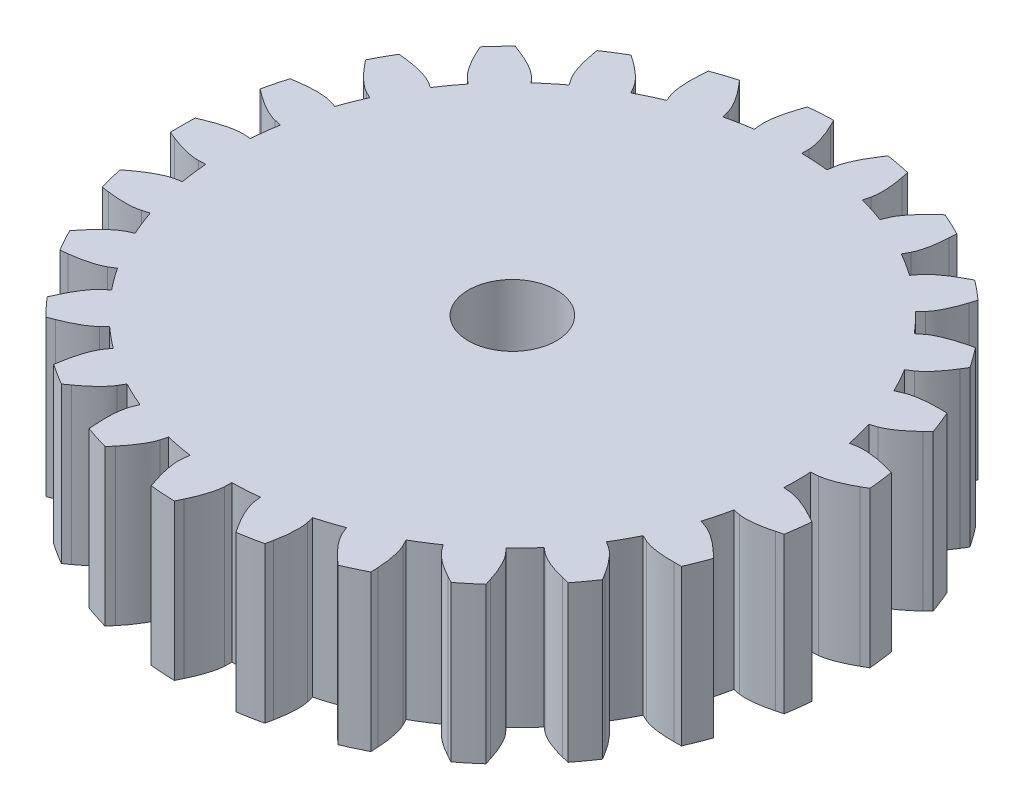
from build123d import *

# Parameters (mm, degrees)
SKETCH5_R           = 27.5
BOSS_EXTRUDE1_DEPTH = 15
BOSS_EXTRUDE2_DEPTH = 15
CIRPATTERN2_COUNT   = 25
SKETCH9_R           = 4.25
CUT_EXTRUDE1_DEPTH  = 48.414177317


with BuildPart() as part:
    # Sketch5 → Boss-Extrude1 (new body)
    with BuildSketch(Plane(origin=(0, 0, 0), x_dir=(1, 0, 0), z_dir=(0, 1, 0))):
        with Locations(Location((0, 0, 0), (0, 0, 270))):
            Circle(SKETCH5_R)
    extrude(amount=BOSS_EXTRUDE1_DEPTH)

    # Sketch7 → Boss-Extrude2 (add)
    with BuildSketch(Plane(origin=(0, 0, 0), x_dir=(1, 0, 0), z_dir=(0, 1, 0))):
        with BuildLine():
            Line((0.419103344, 28.187663113), (0.419103344, 27.496806222))
            ThreePointArc((0.419103344, 27.496806222), (-1.735576403, 27.445177619), (-3.879595269, 27.224965391))
            Line((-3.879595269, 27.224965391), (-3.948649553, 27.912867393))
            add(Edge.make_bspline(
                [(-3.408300207, 30.987456132), (-3.481876172, 30.773678284), (-3.581035388, 30.460011842), (-3.692037809, 30.050014355), (-3.75969093, 29.770412754), (-3.815470726, 29.509231584), (-3.860426563, 29.266893651), (-3.895615791, 29.043778597), (-3.922128058, 28.840221794), (-3.960523355, 28.466443269), (-3.970699746, 28.158767672), (-3.948649553, 27.912867393)],
                knots=[0, 0, 0, 0, 0.215964682, 0.314109795, 0.405696755, 0.490725563, 0.569196219, 0.641108722, 0.706463074, 0.765259273, 1, 1, 1, 1], degree=3))
            add(Edge.make_bspline(
                [(-3.408300207, 30.987456132), (-3.260286585, 31.433974048), (-3.186933306, 31.649953493)],
                knots=[0, 0, 0, 1, 1, 1], degree=2))
            ThreePointArc((-3.186933306, 31.649953493), (-1.997366426, 31.747230231), (-0.804987629, 31.799812813))
            add(Edge.make_bspline(
                [(-0.502333335, 31.17028407), (-0.70514336, 31.594730034), (-0.804987629, 31.799812813)],
                knots=[0, 0, 0, 1, 1, 1], degree=2))
            add(Edge.make_bspline(
                [(-0.502333335, 31.17028407), (-0.40254407, 30.967413438), (-0.264853924, 30.668648295), (-0.103340479, 30.275796053), (-0.001177451, 30.006878378), (0.086897185, 29.754747763), (0.161871529, 29.519955197), (0.22474701, 29.303009852), (0.276562653, 29.104381023), (0.361502062, 28.73836206), (0.410160187, 28.434388017), (0.419103344, 28.187663113)],
                knots=[0, 0, 0, 0, 0.215964682, 0.314109795, 0.405696755, 0.490725563, 0.569196219, 0.641108722, 0.706463074, 0.765259273, 1, 1, 1, 1], degree=3))
        make_face()
    boss_extrude2 = extrude(amount=BOSS_EXTRUDE2_DEPTH)

    # CirPattern2: Boss-Extrude2 ×25 about axis
    cirpattern2_axis = Axis((0, 15, 0), (0, 1, 0))
    for i in range(1, CIRPATTERN2_COUNT):
        add(boss_extrude2.rotate(cirpattern2_axis, i * 360 / CIRPATTERN2_COUNT))

    # Sketch9 → Cut-Extrude1 (cut, through all)
    with BuildSketch(Plane(origin=(0, 15, 0), x_dir=(1, 0, 0), z_dir=(0, 1, 0))):
        with Locations(Location((0, 0, 0), (0, 0, 270))):
            Circle(SKETCH9_R)
    extrude(amount=-CUT_EXTRUDE1_DEPTH, mode=Mode.SUBTRACT)


solid = part.part
